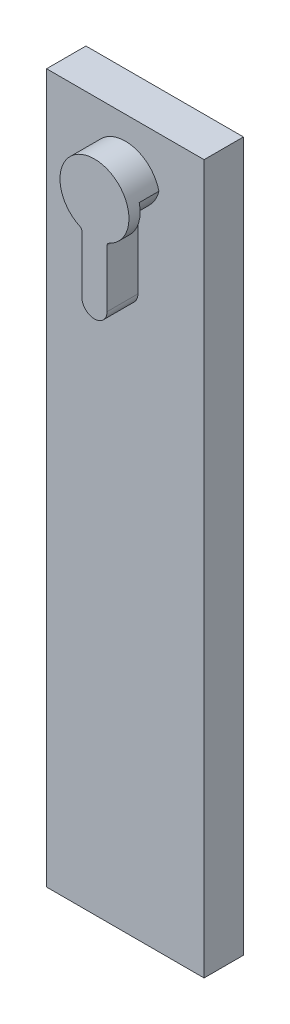
from build123d import *

# Parameters (mm, degrees)
SKETCH1_W           = 25.4
SKETCH1_H           = 114.3
BOSS_EXTRUDE1_DEPTH = 6.35
SKETCH2_R           = 5.5626
BOSS_EXTRUDE2_DEPTH = 3.175
SKETCH3_R           = 5.5626
BOSS_EXTRUDE3_DEPTH = 1.799999956
BOSS_EXTRUDE4_REACH = 119.26
CUT_EXTRUDE1_START  = -4.974999956
CUT_EXTRUDE1_DEPTH  = 4.974999956
FILLET1_R           = 0.508


with BuildPart() as part:
    # Sketch1 → Boss-Extrude1 (new body)
    with BuildSketch(Plane.XY):
        with Locations((12.7, 57.15)):
            Rectangle(SKETCH1_W, SKETCH1_H)
    extrude(amount=-BOSS_EXTRUDE1_DEPTH)

    # Sketch2 → Boss-Extrude2 (add)
    with BuildSketch(Plane.XY):
        with Locations(Location((12.7, 107.5182, 0), (0, 0, 180))):
            Circle(SKETCH2_R)
    extrude(amount=BOSS_EXTRUDE2_DEPTH)

    # Sketch3 → Boss-Extrude3 (add)
    with BuildSketch(Plane.XY.offset(3.175)):
        with Locations(Location((12.7, 104.9782, 0), (0, 0, 166.802375663))):
            Circle(SKETCH3_R)
    extrude(amount=BOSS_EXTRUDE3_DEPTH)

    # Boss-Extrude4: up to this face of the body (flat: up to its plane)
    boss_extrude4_end = Plane(part.part.faces().sort_by_distance((12.7, 104.9782, 4.974999956))[0])
    # Sketch4 → Boss-Extrude4 (add, up to the picked face)
    with BuildSketch(Plane.XY, mode=Mode.PRIVATE) as boss_extrude4_sk1:
        with BuildLine():
            Line((14.732, 107.5182), (14.732, 90.2208))
            ThreePointArc((14.732, 90.2208), (12.7, 88.1888), (10.668, 90.2208))
            Line((10.668, 90.2208), (10.668, 107.5182))
            ThreePointArc((10.668, 107.5182), (12.7, 109.5502), (14.732, 107.5182))
        make_face()
    boss_extrude4_tool1 = split(extrude(boss_extrude4_sk1.sketch, amount=BOSS_EXTRUDE4_REACH, mode=Mode.PRIVATE), bisect_by=boss_extrude4_end, keep=Keep.BOTH, mode=Mode.PRIVATE)
    add(boss_extrude4_tool1.solids().sort_by(Axis((12.7, 98.8695, 0), (0, 0, 1)))[0])

    # Sketch5 → Cut-Extrude1 (cut)
    with BuildSketch(Plane.XY.offset(4.974999956).offset(CUT_EXTRUDE1_START)):
        with BuildLine():
            Line((7.1374, 114.3), (7.1374, 104.9782))
            ThreePointArc((7.1374, 104.9782), (12.7, 110.5408), (18.2626, 104.9782))
            Line((18.2626, 104.9782), (18.2626, 114.3))
            Line((18.2626, 114.3), (7.1374, 114.3))
        make_face()
    extrude(amount=CUT_EXTRUDE1_DEPTH, mode=Mode.SUBTRACT)

    # Fillet1
    fillet1_edges = [part.edges().sort_by_distance(p)[0] for p in [
        (10.668, 102.340025152, 1.5875),
        (10.668, 99.800025152, 4.074999978),
        (14.732, 102.340025152, 1.5875),
        (14.732, 99.800025152, 4.074999978),
    ]]
    fillet(fillet1_edges, radius=FILLET1_R)


solid = part.part
